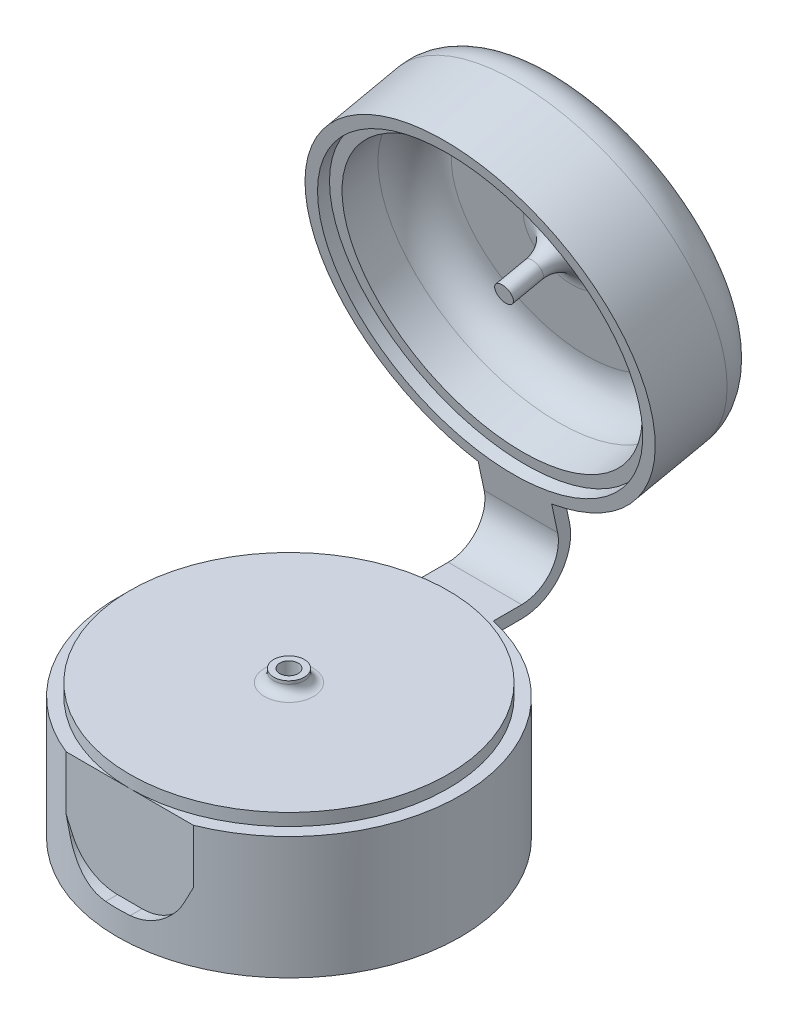
from build123d import *

# Parameters (mm, degrees)
CUT_EXTRUDE1_DEPTH  = 8.5
BOSS_EXTRUDE1_DEPTH = 3
FILLET1_R           = 3


with BuildPart() as part:
    # Sketch1 → Revolve1 (revolve)
    with BuildSketch(Plane(origin=(0, 0, 0), x_dir=(0, 0, -1), z_dir=(1, 0, 0))):
        Polygon((-2, 0), (-13, 0), (-13, -1), (-14, -1), (-14, -11), (-12, -11), (-12, -2), (-2, -2), align=None)
    revolve(axis=Axis((0, 0, 0), (0, -1, 0)))

    # Sketch3 → Cut-Extrude1 (cut)
    with BuildSketch(Plane.XY.offset(13)):
        with BuildLine():
            Line((1, -9), (-1, -9))
            ThreePointArc((-1, -9), (-3.17855614, -8.354682272), (-4.654181831, -6.626946572))
            Line((-4.654181831, -6.626946572), (-7.159459855, -1))
            Line((-7.159459855, -1), (7.159459855, -1))
            Line((7.159459855, -1), (4.654181831, -6.626946572))
            ThreePointArc((4.654181831, -6.626946572), (3.17855614, -8.354682272), (1, -9))
        make_face()
    extrude(amount=CUT_EXTRUDE1_DEPTH, mode=Mode.SUBTRACT)

    # Sketch4 → Boss-Extrude1 (add, symmetric)
    with BuildSketch(Plane(origin=(0, 0, 0), x_dir=(0, 0, -1), z_dir=(1, 0, 0))):
        with BuildLine():
            Line((13, -1), (16, -1))
            ThreePointArc((16, -1), (18.331437884, 0.112038827), (18.934442802, 2.623735072))
            Line((18.934442802, 2.623735072), (18.31070773, 5.558177875))
            Line((18.31070773, 5.558177875), (19.28885533, 5.766089565))
            Line((19.28885533, 5.766089565), (19.912590403, 2.831646763))
            ThreePointArc((19.912590403, 2.831646763), (19.108583846, -0.517281564), (16, -2))
            Line((16, -2), (13, -2))
            Line((13, -2), (13, -1))
        make_face()
    extrude(amount=BOSS_EXTRUDE1_DEPTH, both=True)

    # Sketch5 → Revolve2 (revolve)
    with BuildSketch(Plane(origin=(0, 0, 0), x_dir=(0, 0, -1), z_dir=(1, 0, 0)), mode=Mode.PRIVATE) as revolve2_sk:
        Polygon((18.518619421, 4.580030274), (27.321947827, 6.451235491), (24.411184156, 20.145301902), (22.454888954, 19.72947852), (24.949829244, 7.991707311), (19.08094364, 6.744237166), (19.28885533, 5.766089565), (18.31070773, 5.558177875), align=None)
    revolve(revolve2_sk.sketch.rotate(Axis((0, 20.145301902, -24.411184156), (0, -0.20791169081776387, 0.9781476007338047)), 180), axis=Axis((0, 20.145301902, -24.411184156), (0, -0.20791169081776387, 0.9781476007338047)))

    # Fillet1
    fillet1_edges = [part.edges().sort_by_distance(p)[0] for p in [
        (0, 6.451235491, -27.321947827),
        (0, 7.991707311, -24.949829244),
    ]]
    fillet(fillet1_edges, radius=FILLET1_R)

    # Sketch6 → Revolve3 (revolve)
    with BuildSketch(Plane(origin=(0, 0, 0), x_dir=(0, 0, -1), z_dir=(1, 0, 0))):
        with BuildLine():
            Line((0.75, 1), (0.75, -0.75))
            ThreePointArc((0.75, -0.75), (1.116116524, -1.633883476), (2, -2))
            Line((2, -2), (2, 0))
            ThreePointArc((2, 0), (1.469669914, 0.219669914), (1.25, 0.75))
            Line((1.25, 0.75), (1.25, 1))
            Line((1.25, 1), (0.75, 1))
        make_face()
    revolve(axis=Axis((0, 0, 0), (0, 1, 0)))

    # Sketch7 → Revolve4 (revolve)
    with BuildSketch(Plane(origin=(0, 0, 0), x_dir=(0, 0, -1), z_dir=(1, 0, 0)), mode=Mode.PRIVATE) as revolve4_sk:
        with BuildLine():
            Line((22.454888954, 19.72947852), (17.560305242, 18.689102635))
            Line((17.560305242, 18.689102635), (17.404371474, 19.422713336))
            Line((17.404371474, 19.422713336), (19.853586184, 19.943309993))
            ThreePointArc((19.853586184, 19.943309993), (21.430483377, 21.027081408), (21.779175959, 22.908458222))
            Line((21.779175959, 22.908458222), (22.454888954, 19.72947852))
        make_face()
    revolve(revolve4_sk.sketch.rotate(Axis((0, 19.72947852, -22.454888954), (0, -0.20791169081776406, 0.9781476007338047)), 192.373625116), axis=Axis((0, 19.72947852, -22.454888954), (0, -0.20791169081776406, 0.9781476007338047)))


solid = part.part
